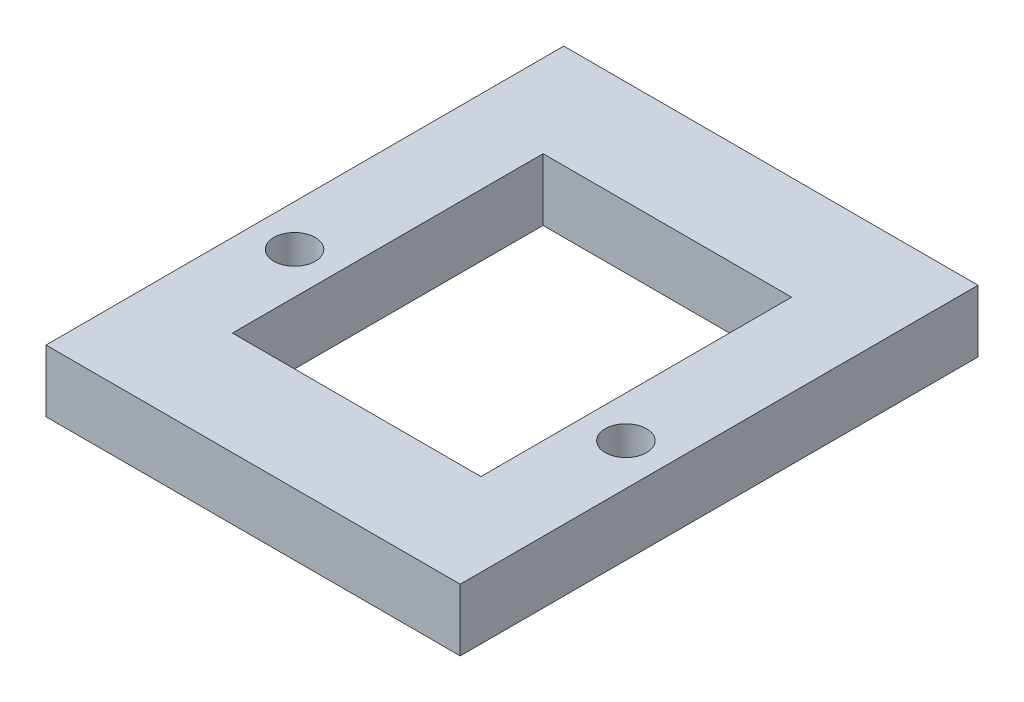
from build123d import *

# Parameters (mm, degrees)
SKETCH1_W           = 20
SKETCH1_H           = 25
SKETCH1_R           = 1
SKETCH1_W_2         = 12
SKETCH1_H_2         = 15
BOSS_EXTRUDE1_DEPTH = 1.5


with BuildPart() as part:
    # Sketch1 → Boss-Extrude1 (new, symmetric)
    with BuildSketch(Plane(origin=(0, 0, 0), x_dir=(1, 0, 0), z_dir=(0, 1, 0))):
        Rectangle(SKETCH1_W, SKETCH1_H)
        with Locations(Location((-8, -2.5, 0), (0, 0, 270))):
            Circle(SKETCH1_R, mode=Mode.SUBTRACT)
        with Locations(Location((8, -2.5, 0), (0, 0, 90))):
            Circle(SKETCH1_R, mode=Mode.SUBTRACT)
        Rectangle(SKETCH1_W_2, SKETCH1_H_2, mode=Mode.SUBTRACT)
    extrude(amount=BOSS_EXTRUDE1_DEPTH, both=True)


solid = part.part
